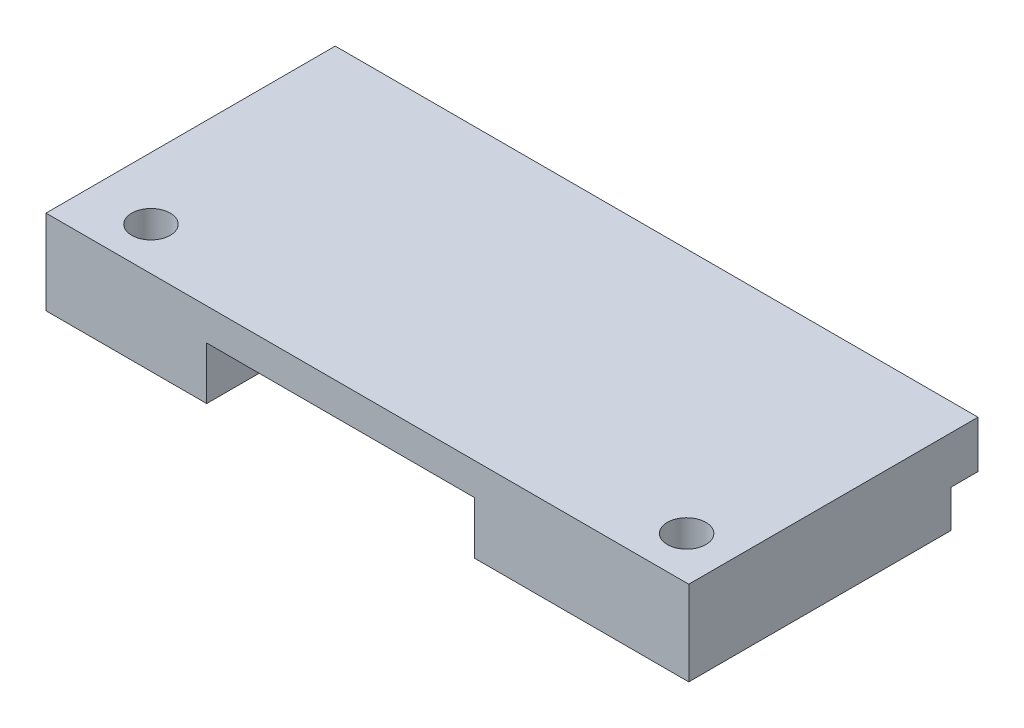
from build123d import *

# Parameters (mm, degrees)
SKETCH1_W                  = 60
SKETCH1_H                  = 2.5
BOSS_EXTRUDE1_DEPTH        = 2.5
SKETCH2_W                  = 60
SKETCH2_H                  = 5
BOSS_EXTRUDE2_DEPTH        = 3
SKETCH5_W                  = 60
SKETCH5_H                  = 5.5
BOSS_EXTRUDE4_DEPTH        = 22
SKETCH6_W                  = 60
SKETCH6_H                  = 27
BOSS_EXTRUDE5_DEPTH        = 2.4
F_3_6_3_6_DIAMETER_HOLE1_D = 3.6
SKETCH9_W                  = 25
SKETCH9_H                  = 9.609635329
CUT_EXTRUDE1_DEPTH         = 42.126755282
SKETCH10_W                 = 60
SKETCH10_H                 = 3.5
CUT_EXTRUDE2_DEPTH         = 40.530494558


with BuildPart() as part:
    # Sketch1 → Boss-Extrude1 (new body)
    with BuildSketch(Plane(origin=(0, 0, 0), x_dir=(1, 0, 0), z_dir=(0, 1, 0))):
        Rectangle(SKETCH1_W, SKETCH1_H)
    extrude(amount=BOSS_EXTRUDE1_DEPTH)

    # Sketch2 → Boss-Extrude2 (add)
    with BuildSketch(Plane(origin=(0, 2.5, 0), x_dir=(1, 0, 0), z_dir=(0, 1, 0))):
        with Locations((0, 1.25)):
            Rectangle(SKETCH2_W, SKETCH2_H)
    extrude(amount=BOSS_EXTRUDE2_DEPTH)

    # Sketch5 → Boss-Extrude4 (add)
    with BuildSketch(Plane.XY.offset(1.25)):
        with Locations((0, 2.75)):
            Rectangle(SKETCH5_W, SKETCH5_H)
    extrude(amount=BOSS_EXTRUDE4_DEPTH)

    # Sketch6 → Boss-Extrude5 (add)
    with BuildSketch(Plane(origin=(0, 5.5, 0), x_dir=(1, 0, 0), z_dir=(0, 1, 0))):
        with Locations((0, -9.75)):
            Rectangle(SKETCH6_W, SKETCH6_H)
    extrude(amount=BOSS_EXTRUDE5_DEPTH)

    # Ø3.6 (3.6) Diameter Hole1 (through all)
    with Locations(Plane(origin=(0, 7.9, 0), x_dir=(1, 0, 0), z_dir=(0, 1, 0))):
        with Locations((-24.2, -19.25), (25.8, -19.25)):
            Hole(F_3_6_3_6_DIAMETER_HOLE1_D / 2)

    # Sketch9 → Cut-Extrude1 (cut, through all)
    with BuildSketch(Plane(origin=(0, 0, -3.75), x_dir=(-1, 0, 0), z_dir=(0, 0, -1))):
        with Locations((2.5, 0.095182336)):
            Rectangle(SKETCH9_W, SKETCH9_H)
    extrude(amount=-CUT_EXTRUDE1_DEPTH, mode=Mode.SUBTRACT)

    # Sketch10 → Cut-Extrude2 (cut, through all)
    with BuildSketch(Plane(origin=(0, 0, -1.25), x_dir=(-1, 0, 0), z_dir=(0, 0, -1))):
        with Locations((0, 1.75)):
            Rectangle(SKETCH10_W, SKETCH10_H)
    extrude(amount=CUT_EXTRUDE2_DEPTH, mode=Mode.SUBTRACT)


solid = part.part
